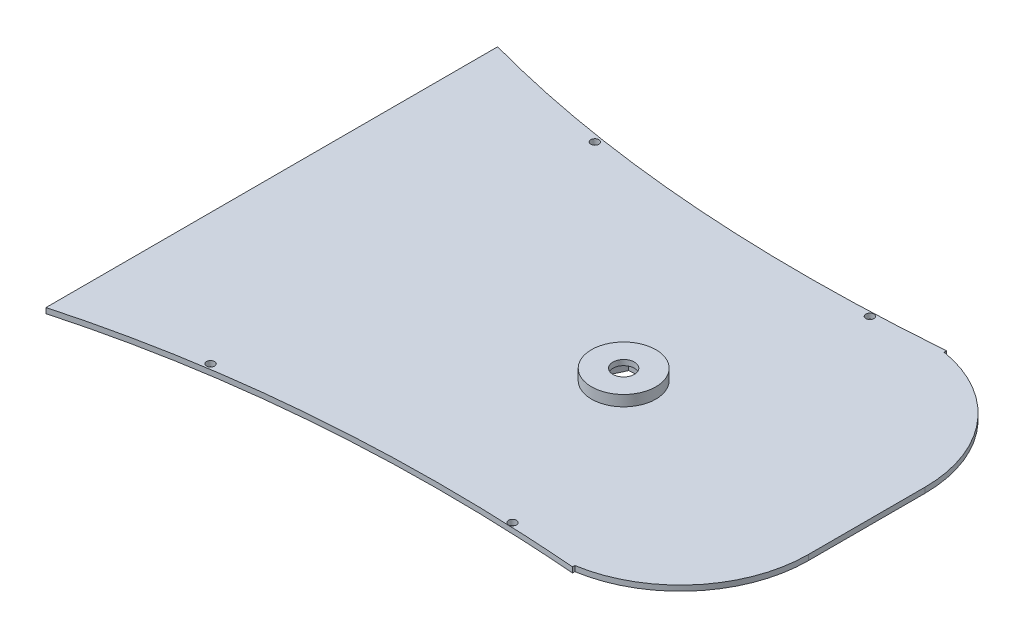
from build123d import *

# Parameters (mm, degrees)
BOSS_EXTRUDE3_DEPTH = 2
SKETCH5_R           = 1.5
CUT_EXTRUDE1_DEPTH  = 2
SKETCH7_R           = 12
BOSS_EXTRUDE4_DEPTH = 6
CUT_EXTRUDE2_DEPTH  = 4
CUT_EXTRUDE3_REACH  = 321.177
SKETCH9_R           = 4


with BuildPart() as part:
    # Sketch2 → Boss-Extrude3 (new body)
    with BuildSketch(Plane(origin=(0, -145, 0), x_dir=(1, 0, 0), z_dir=(0, 1, 0))):
        with BuildLine():
            Line((266.76742756, -73.602742484), (266.76742756, -72.760276474))
            ThreePointArc((266.76742756, -72.760276474), (295.4188355, -56.546474798), (306.76742756, -25.643400517))
            Line((306.76742756, -25.643400517), (306.76742756, 17.897133595))
            ThreePointArc((306.76742756, 17.897133595), (295.4188355, 48.800207875), (266.76742756, 65.014009552))
            Line((266.76742756, 65.014009552), (266.76742756, 65.935160893))
            add(Edge.make_bspline(
                [(266.76742756, 65.935160893), (259.107155635, 65.341277023), (243.742271939, 64.387770992), (220.806823342, 63.7720731), (197.927488127, 64.011220421), (175.127118785, 65.165170469), (152.40787224, 67.285858288), (129.776603883, 70.444148029), (110.989691022, 74.011185897), (96.0146349, 77.459243676), (88.529196958, 79.398823116), (84.805077121, 80.412721287)],
                knots=[0.001455315, 0.001455315, 0.001455315, 0.001455315, 0.126054107, 0.2506529, 0.375251692, 0.499850484, 0.624449276, 0.749048068, 0.87364686, 0.935946256, 0.998245653, 0.998245653, 0.998245653, 0.998245653], degree=3))
            Line((84.805077121, 80.412721287), (84.805077121, -88.045510644))
            add(Edge.make_bspline(
                [(84.805077121, -88.045510644), (88.529310634, -87.032335524), (96.014951065, -85.094214441), (110.990402818, -81.649056168), (129.777732342, -78.085640943), (152.409330828, -74.931693387), (175.128665838, -72.815352211), (197.928863022, -71.6657552), (220.807845871, -71.43096305), (243.742803934, -72.051009048), (259.107355476, -73.007418463), (266.76742756, -73.602742484)],
                knots=[0.001754687, 0.001754687, 0.001754687, 0.001754687, 0.064054081, 0.126353476, 0.250952265, 0.375551054, 0.500149843, 0.624748632, 0.749347421, 0.873946211, 0.998545, 0.998545, 0.998545, 0.998545], degree=3))
        make_face()
    extrude(amount=BOSS_EXTRUDE3_DEPTH)

    # Sketch5 → Cut-Extrude1 (cut)
    with BuildSketch(Plane.XZ.offset(145)):
        with Locations((241.293747278, 70.518625741)):
            Circle(SKETCH5_R)
        with Locations((133.692207926, 75.539122499)):
            Circle(SKETCH5_R)
        with Locations((133.692207926, -67.792864213)):
            Circle(SKETCH5_R)
        with Locations((241.293747278, -62.772367455)):
            Circle(SKETCH5_R)
    extrude(amount=-CUT_EXTRUDE1_DEPTH, mode=Mode.SUBTRACT)

    # Sketch7 → Boss-Extrude4 (add)
    with BuildSketch(Plane.XZ.offset(145)):
        with Locations((216.15176331, 3.918032565)):
            Circle(SKETCH7_R)
    extrude(amount=-BOSS_EXTRUDE4_DEPTH)

    # Sketch8 → Cut-Extrude2 (cut)
    with BuildSketch(Plane.XZ.offset(145)):
        Polygon((219.337574148, -2.87784432), (223.630070752, 3.279087239), (220.444259915, 10.074964125), (212.965952472, 10.71390945), (208.673455868, 4.556977891), (211.859266705, -2.238898995), align=None)
    extrude(amount=-CUT_EXTRUDE2_DEPTH, mode=Mode.SUBTRACT)

    # Sketch9 → Cut-Extrude3 (cut, up to next)
    with BuildSketch(Plane.XZ.offset(141), mode=Mode.PRIVATE) as cut_extrude3_sk1:
        with Locations((216.15176331, 3.918032565)):
            Circle(SKETCH9_R)
    cut_extrude3_tool1 = extrude(cut_extrude3_sk1.sketch, amount=-CUT_EXTRUDE3_REACH, mode=Mode.PRIVATE) & part.part
    add(cut_extrude3_tool1.solids().sort_by_distance((216.151763, -141, 3.918033))[0], mode=Mode.SUBTRACT)


solid = part.part
